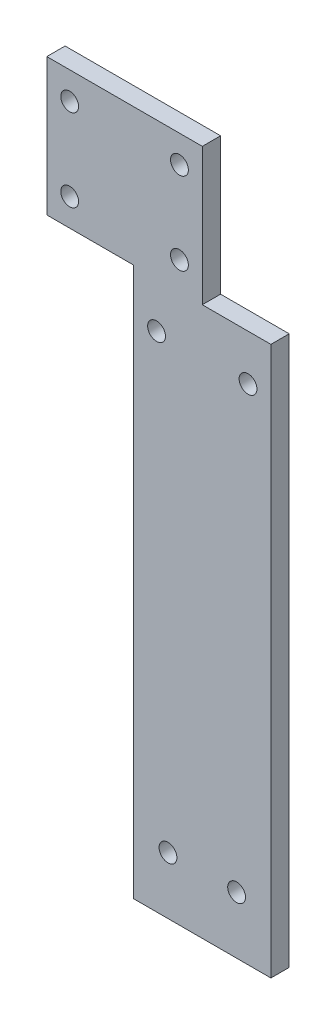
from build123d import *

# Parameters (mm, degrees)
SKETCH_1_R      = 1.95
EXTRUDE_1_DEPTH = 4


with BuildPart() as part:
    # 草图1 → 凸台-拉伸1 (new body)
    with BuildSketch(Plane.XY):
        Polygon((0, 0), (30, 0), (30, 99.927726458), (30, 120), (15, 120), (15, 150), (-19, 150), (-19, 120), (0, 120), (0, 100), align=None)
        with Locations((7.5, 12.5)):
            Circle(SKETCH_1_R, mode=Mode.SUBTRACT)
        with Locations((22.5, 12.5)):
            Circle(SKETCH_1_R, mode=Mode.SUBTRACT)
        with Locations((-14, 144)):
            Circle(SKETCH_1_R, mode=Mode.SUBTRACT)
        with Locations((10, 144)):
            Circle(SKETCH_1_R, mode=Mode.SUBTRACT)
        with Locations((-14, 126)):
            Circle(SKETCH_1_R, mode=Mode.SUBTRACT)
        with Locations((10, 126)):
            Circle(SKETCH_1_R, mode=Mode.SUBTRACT)
        with Locations((5, 110)):
            Circle(SKETCH_1_R, mode=Mode.SUBTRACT)
        with Locations((25, 110)):
            Circle(SKETCH_1_R, mode=Mode.SUBTRACT)
    extrude(amount=EXTRUDE_1_DEPTH)


solid = part.part
